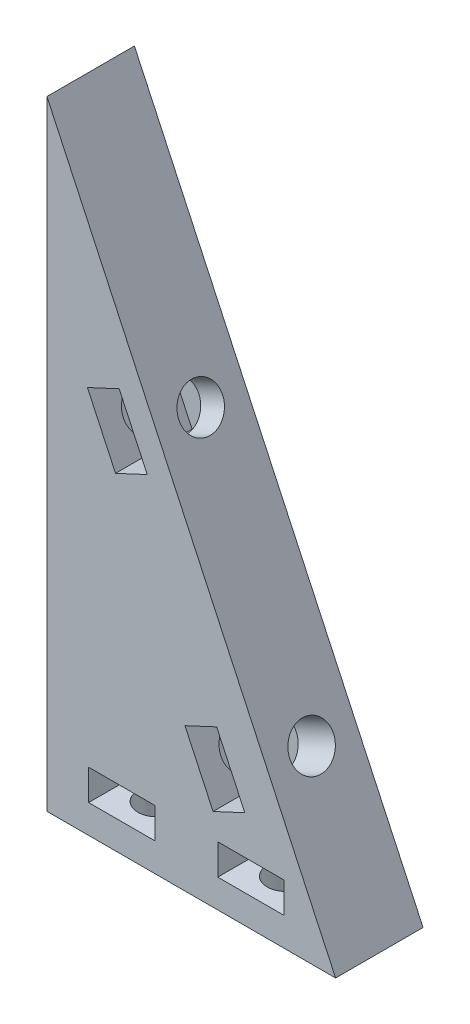
from build123d import *

# Parameters (mm, degrees)
BOSS_EXTRUDE1_DEPTH = 10
SKETCH2_W           = 5.8
SKETCH2_H           = 3.8
BOSS_EXTRUDE2_DEPTH = 2
SKETCH3_R           = 2.15
CUT_EXTRUDE1_DEPTH  = 12
CUT_EXTRUDE5_START  = -10
SKETCH4_W           = 7.6
SKETCH4_H           = 3.5
CUT_EXTRUDE5_DEPTH  = 8.75
SKETCH7_W           = 7.6
SKETCH7_H           = 3.5
CUT_EXTRUDE6_DEPTH  = 8.75
CUT_EXTRUDE7_DEPTH  = 8.75
SKETCH12_R          = 2.5
CUT_EXTRUDE8_DEPTH  = 10


with BuildPart() as part:
    # Sketch1 → Boss-Extrude1 (new body)
    with BuildSketch(Plane.XY):
        Polygon((0, 70.768728377), (0, 0), (33, 0), align=None)
    extrude(amount=BOSS_EXTRUDE1_DEPTH)

    # Sketch2 → Boss-Extrude2 (add)
    with BuildSketch(Plane(origin=(0, 0, 0), x_dir=(-1, 0, 0), z_dir=(0, -1, 0))):
        with Locations((-16.5, -5)):
            Rectangle(SKETCH2_W, SKETCH2_H)
    extrude(amount=BOSS_EXTRUDE2_DEPTH)

    # Sketch3 → Cut-Extrude1 (cut)
    with BuildSketch(Plane(origin=(0, 0, 0), x_dir=(-1, 0, 0), z_dir=(0, -1, 0))):
        with Locations(Location((-23.33, -6, 0), (0, 0, 180))):
            Circle(SKETCH3_R)
        with Locations(Location((-8.55, -6, 0), (0, 0, 180))):
            Circle(SKETCH3_R)
    extrude(amount=-CUT_EXTRUDE1_DEPTH, mode=Mode.SUBTRACT)

    # Sketch4 → Cut-Extrude5 (cut)
    with BuildSketch(Plane(origin=(0, 0, 0), x_dir=(-1, 0, 0), z_dir=(0, 0, -1)).offset(CUT_EXTRUDE5_START)):
        with Locations((-23.33, 5.001728642)):
            Rectangle(SKETCH4_W, SKETCH4_H)
    extrude(amount=CUT_EXTRUDE5_DEPTH, mode=Mode.SUBTRACT)

    # Sketch7 → Cut-Extrude6 (cut)
    with BuildSketch(Plane.XY.offset(10)):
        with Locations((8.567911565, 5.001728642)):
            Rectangle(SKETCH7_W, SKETCH7_H)
    extrude(amount=-CUT_EXTRUDE6_DEPTH, mode=Mode.SUBTRACT)

    # Sketch10 → Cut-Extrude7 (cut)
    with BuildSketch(Plane.XY.offset(10)):
        Polygon((6.237191143, 40.829617725), (9.862422291, 42.520090772), (8.256472896, 45.964060362), (4.631241748, 44.273587315), align=None)
        Polygon((11.468371686, 39.076121181), (9.862422291, 42.520090772), (6.237191143, 40.829617725), (7.843140537, 37.385648134), align=None)
        Polygon((17.386162964, 12.927131096), (21.011394112, 14.617604143), (19.405444717, 18.061573734), (15.780213569, 16.371100687), align=None)
        Polygon((22.617343506, 11.173634553), (21.011394112, 14.617604143), (17.386162964, 12.927131096), (18.992112358, 9.483161506), align=None)
    extrude(amount=-CUT_EXTRUDE7_DEPTH, mode=Mode.SUBTRACT)

    # Sketch12 → Cut-Extrude8 (cut)
    with BuildSketch(Plane(origin=(27.10599556, 12.639733311, 0), x_dir=(0, 0, -1), z_dir=(0.9063077870366479, 0.422618261740704, 0))):
        with Locations(Location((-5, 34.368249607, 0), (0, 0, 90))):
            Circle(SKETCH12_R)
        with Locations(Location((-5, 4.368249607, 0), (0, 0, 90))):
            Circle(SKETCH12_R)
    extrude(amount=-CUT_EXTRUDE8_DEPTH, mode=Mode.SUBTRACT)


solid = part.part
